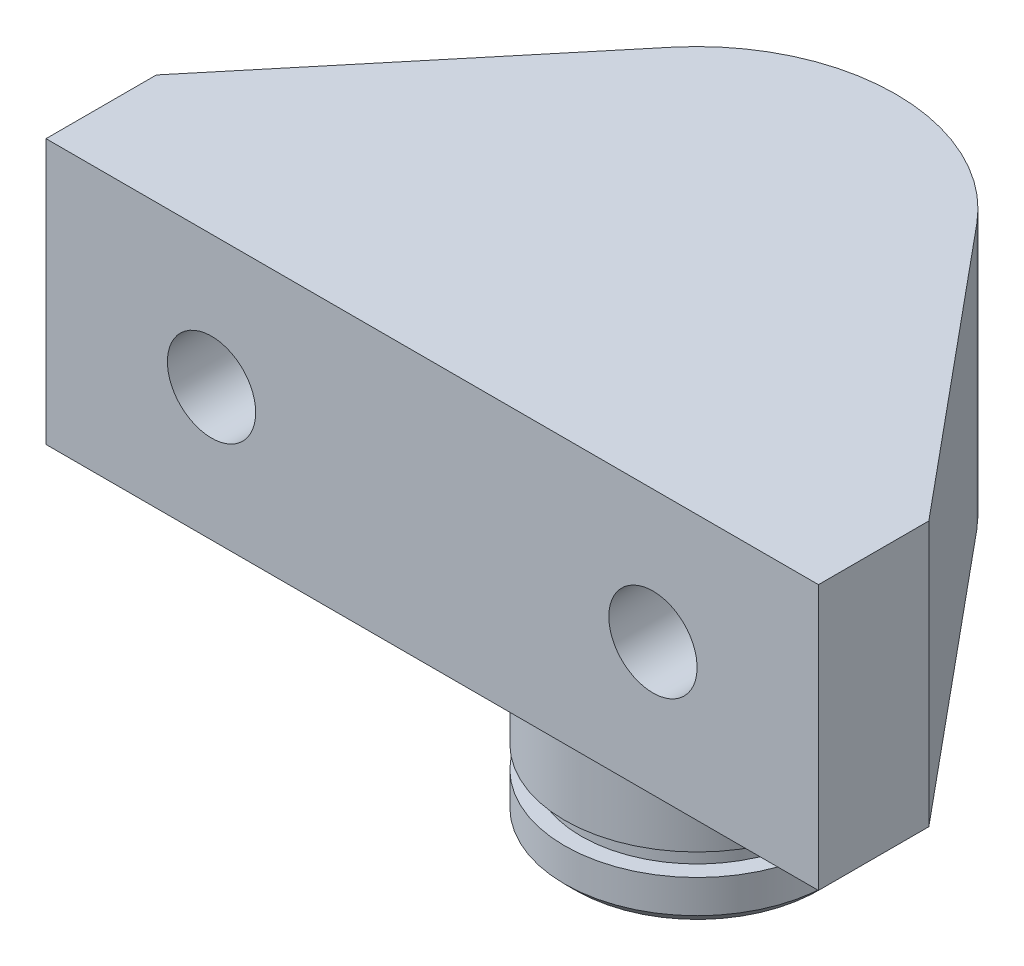
from build123d import *

# Parameters (mm, degrees)
EXTRUDE_1_DEPTH     = 12
SKETCH_2_R          = 6
EXTRUDE_2_DEPTH     = 9
SKETCH_3_R          = 5.25
EXTRUDE_3_DEPTH     = 1
SKETCH_4_R          = 6
EXTRUDE_4_DEPTH     = 2
CHAMFER_1_SIZE      = 0.5
SKETCH_5_R          = 2
CUT_EXTRUDE_1_DEPTH = 5


with BuildPart() as part:
    # 草图1 → 凸台-拉伸1 (new body)
    with BuildSketch(Plane(origin=(0, 0, 0), x_dir=(1, 0, 0), z_dir=(0, 1, 0))):
        with BuildLine():
            Line((-17.5, 6.09769995), (-6.926984364, 18.843732288))
            ThreePointArc((-6.926984364, 18.843732288), (0, 22.09769995), (6.926984364, 18.843732288))
            Line((6.926984364, 18.843732288), (17.5, 6.09769995))
            Line((17.5, 6.09769995), (17.5, 1.09769995))
            Line((17.5, 1.09769995), (-17.5, 1.09769995))
            Line((-17.5, 1.09769995), (-17.5, 6.09769995))
        make_face()
    extrude(amount=EXTRUDE_1_DEPTH)

    # 草图2 → 凸台-拉伸2 (add)
    with BuildSketch(Plane(origin=(0, 0, 0), x_dir=(1, 0, 0), z_dir=(0, 1, 0))):
        with Locations(Location((0, 13.09769995, 0), (0, 0, 270))):
            Circle(SKETCH_2_R)
    extrude(amount=-EXTRUDE_2_DEPTH)

    # 草图3 → 凸台-拉伸3 (add)
    with BuildSketch(Plane(origin=(0, -9, 0), x_dir=(-1, 0, 0), z_dir=(0, -1, 0))):
        with Locations(Location((0, 13.09769995, 0), (0, 0, 270))):
            Circle(SKETCH_3_R)
    extrude(amount=EXTRUDE_3_DEPTH)

    # 草图4 → 凸台-拉伸4 (add)
    with BuildSketch(Plane(origin=(0, -10, 0), x_dir=(-1, 0, 0), z_dir=(0, -1, 0))):
        with Locations(Location((0, 13.09769995, 0), (0, 0, 270))):
            Circle(SKETCH_4_R)
    extrude(amount=EXTRUDE_4_DEPTH)

    # 倒角1
    chamfer_1_edges = [part.edges().sort_by_distance(p)[0] for p in [
        (0, -12, -19.09769995),
    ]]
    chamfer(chamfer_1_edges, length=CHAMFER_1_SIZE)

    # 草图5 → 切除-拉伸1 (cut)
    with BuildSketch(Plane.XY.offset(-1.09769995)):
        with Locations((-10, 6)):
            Circle(SKETCH_5_R)
        with Locations(Location((10, 6, 0), (0, 0, 180))):
            Circle(SKETCH_5_R)
    extrude(amount=-CUT_EXTRUDE_1_DEPTH, mode=Mode.SUBTRACT)


solid = part.part
